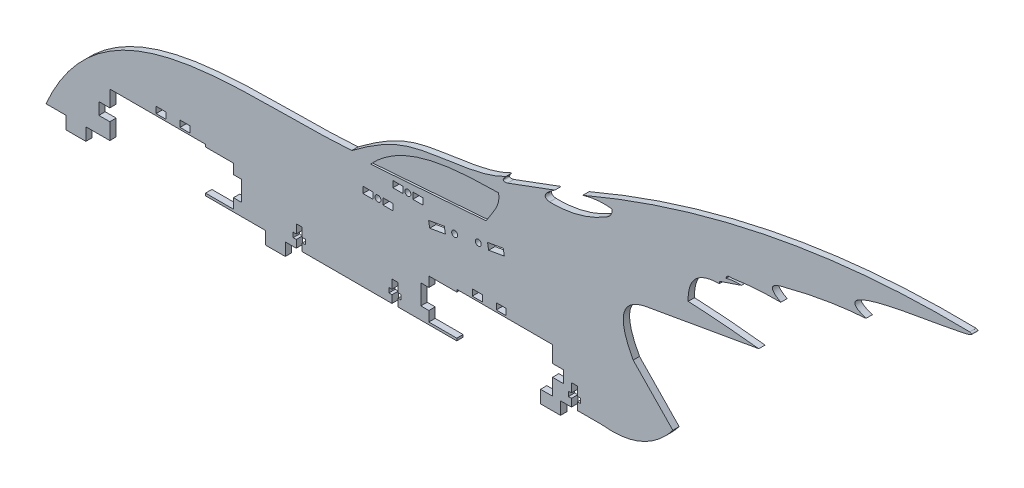
from build123d import *

# Parameters (mm, degrees)
BOSS_EXTRUDE1_DEPTH = 3.175
SKETCH3_W           = 10
SKETCH3_H           = 6.35
BOSS_EXTRUDE2_DEPTH = 3.175
CUT_EXTRUDE1_DEPTH  = 1
CUT_EXTRUDE2_DEPTH  = 309.914260869
SKETCH7_W           = 5
SKETCH7_H           = 3.175
CUT_EXTRUDE3_DEPTH  = 309.914260869
SKETCH8_R           = 1.5
CUT_EXTRUDE4_DEPTH  = 309.914260869
SKETCH9_R           = 1.5
SKETCH9_W           = 5
SKETCH9_H           = 3.175
CUT_EXTRUDE5_DEPTH  = 309.914260869


with BuildPart() as part:
    # Sketch2 → Boss-Extrude1 (new body)
    with BuildSketch(Plane.XY):
        with BuildLine():
            Line((-171.469047232, -34.076589663), (107.072734851, -34.076589663))
            add(Edge.make_bspline(
                [(107.072734851, -34.076589663), (128.968224532, -36.583015685), (142.892082906, -18.715522774)],
                knots=[0, 0, 0, 1, 1, 1], degree=2))
            Line((142.892082906, -18.715522774), (122.99960361, 1.8225486))
            add(Edge.make_bspline(
                [(129.812103759, 28.346921979), (110.367502019, 24.835662341), (122.99960361, 1.8225486)],
                knots=[0, 0, 0, 1, 1, 1], degree=2))
            Line((129.812103759, 28.346921979), (185.982982819, 38.244685161))
            add(Edge.make_bspline(
                [(150.588622768, 41.132714976), (168.332466646, 40.241827569), (185.982982819, 38.244685161)],
                knots=[0, 0, 0, 1, 1, 1], degree=2))
            add(Edge.make_bspline(
                [(166.211544782, 56.600045126), (150.111599454, 56.448151942), (150.588622768, 41.132714976)],
                knots=[0, 0, 0, 1, 1, 1], degree=2))
            Line((166.211544782, 56.600045126), (166.232711914, 57.669663084))
            Line((166.232711914, 57.669663084), (177.243348067, 61.403308501))
            add(Edge.make_bspline(
                [(177.243348067, 61.403308501), (173.339529375, 61.796609349), (169.627135034, 60.610840144)],
                knots=[0, 0, 0, 1, 1, 1], degree=2))
            add(Edge.make_bspline(
                [(169.627135034, 60.610840144), (169.762853876, 62.544945332), (172.402329475, 62.156522878)],
                knots=[0, 0, 0, 1, 1, 1], degree=2))
            add(Edge.make_bspline(
                [(172.402329475, 62.156522878), (184.617311888, 64.041519989), (197.029812567, 63.947302758)],
                knots=[0, 0, 0, 1, 1, 1], degree=2))
            add(Edge.make_bspline(
                [(197.029812567, 63.947302758), (187.73474396, 69.069639789), (198.964387884, 71.402059066)],
                knots=[0, 0, 0, 1, 1, 1], degree=2))
            add(Edge.make_bspline(
                [(198.964387884, 71.402059066), (219.003547299, 76.786528717), (239.76459105, 78.329887141)],
                knots=[0, 0, 0, 1, 1, 1], degree=2))
            add(Edge.make_bspline(
                [(291.780939868, 98.47138823), (303.090852198, 95.717715254), (210.844028254, 88.026417155), (239.76459105, 78.329887141)],
                knots=[0, 0, 0, 0, 1, 1, 1, 1], degree=3))
            add(Edge.make_bspline(
                [(291.780939868, 98.47138823), (190.608851514, 100.539390251), (97.737935683, 60.775941524)],
                knots=[0, 0, 0, 1, 1, 1], degree=2))
            add(Edge.make_bspline(
                [(97.737935683, 60.775941524), (104.92881908, 63.001143493), (112.379572637, 62.156522878)],
                knots=[0, 0, 0, 1, 1, 1], degree=2))
            add(Edge.make_bspline(
                [(112.379572637, 62.156522878), (112.730110756, 59.051830939), (109.55036868, 57.311722682)],
                knots=[0, 0, 0, 1, 1, 1], degree=2))
            add(Edge.make_bspline(
                [(109.55036868, 57.311722682), (96.530025853, 49.246897899), (81.058579137, 49.55282081)],
                knots=[0, 0, 0, 1, 1, 1], degree=2))
            add(Edge.make_bspline(
                [(81.058579137, 49.55282081), (75.642299748, 50.628036984), (83.696612356, 55.998318906)],
                knots=[0, 0, 0, 1, 1, 1], degree=2))
            Line((83.696612356, 55.998318906), (60.023408157, 47.198036308))
            add(Edge.make_bspline(
                [(60.023408157, 47.198036308), (56.150260782, 46.24516321), (59.12376331, 49.613311176)],
                knots=[0, 0, 0, 1, 1, 1], degree=2))
            add(Edge.make_bspline(
                [(59.12376331, 49.613311176), (44.292473838, 41.921501166), (13.209344651, 43.405332099), (-7.707186428, 29.993825045), (-18.106560521, 22.301338951)],
                knots=[0, 0, 0, 0, 0.606338938, 1, 1, 1, 1], degree=3))
            add(Edge.make_bspline(
                [(-18.106560521, 22.301338951), (-73.30010729, 18.178725753), (-142.381543794, 32.928841514), (-171.469047232, -34.076589663)],
                knots=[0, 0, 0, 0, 1, 1, 1, 1], degree=3))
        make_face()
    extrude(amount=BOSS_EXTRUDE1_DEPTH)

    # Sketch3 → Boss-Extrude2 (add)
    with BuildSketch(Plane.XY.offset(3.175)):
        with Locations((-156.469047232, -37.251589663)):
            Rectangle(SKETCH3_W, SKETCH3_H)
        with Locations((-56.469047232, -37.251589663)):
            Rectangle(SKETCH3_W, SKETCH3_H)
        with Locations((81.530952768, -37.251589663)):
            Rectangle(SKETCH3_W, SKETCH3_H)
    extrude(amount=-BOSS_EXTRUDE2_DEPTH)

    # Sketch4 → Cut-Extrude1 (cut)
    with BuildSketch(Plane.XY.offset(3.175)):
        with BuildLine():
            Line((-8.735344321, 21.076667257), (49.27249451, 25.443679203))
            add(Edge.make_bspline(
                [(55.435775055, 40.720887474), (56.710717132, 34.955549426), (51.7521577, 29.95185464), (49.27249451, 25.443679203)],
                knots=[0, 0, 0, 0, 1, 1, 1, 1], degree=3))
            add(Edge.make_bspline(
                [(55.435775055, 40.720887474), (33.054612951, 40.360145045), (7.874054379, 39.272954497), (-8.735344321, 21.076667257)],
                knots=[0, 0, 0, 0, 1, 1, 1, 1], degree=3))
        make_face()
    extrude(amount=-CUT_EXTRUDE1_DEPTH, mode=Mode.SUBTRACT)

    # Sketch5 → Cut-Extrude2 (cut, through all)
    with BuildSketch(Plane.XY.offset(3.175)):
        Polygon((-45.969047232, -34.076589663), (-42.969047232, -34.076589663), (-42.969047232, -30.276589663), (-41.419047232, -30.276589663), (-41.419047232, -27.876589663), (-42.969047232, -27.876589663), (-42.969047232, -23.426589663), (-45.969047232, -23.426589663), (-45.969047232, -27.876589663), (-47.519047232, -27.876589663), (-47.519047232, -30.276589663), (-45.969047232, -30.276589663), align=None)
        Polygon((2.030952768, -30.276589663), (2.030952768, -34.076589663), (5.030952768, -34.076589663), (5.030952768, -30.276589663), (6.580952768, -30.276589663), (6.580952768, -27.876589663), (5.030952768, -27.876589663), (5.030952768, -23.426589663), (2.030952768, -23.426589663), (2.030952768, -27.876589663), (0.480952768, -27.876589663), (0.480952768, -30.276589663), align=None)
        Polygon((92.030952768, -30.276589663), (92.030952768, -34.076589663), (95.030952768, -34.076589663), (95.030952768, -30.276589663), (96.580952768, -30.276589663), (96.580952768, -27.876589663), (95.030952768, -27.876589663), (95.030952768, -23.426589663), (92.030952768, -23.426589663), (92.030952768, -27.876589663), (90.480952768, -27.876589663), (90.480952768, -30.276589663), align=None)
    extrude(amount=-CUT_EXTRUDE2_DEPTH, mode=Mode.SUBTRACT)

    # Sketch7 → Cut-Extrude3 (cut, through all)
    with BuildSketch(Plane.XY.offset(3.175)):
        Polygon((-91.469047232, -32.876589663), (-77.469047232, -32.876589663), (-77.469047232, -27.876589663), (-73.469047232, -27.876589663), (-73.469047232, -17.876589663), (-77.469047232, -17.876589663), (-77.469047232, -12.876589663), (-91.469047232, -12.876589663), (-91.469047232, -11.676589663), (-139.469047232, -11.676589663), (-139.469047232, -19.876589663), (-144.969047232, -19.876589663), (-144.969047232, -25.876589663), (-139.469047232, -25.876589663), (-139.469047232, -34.076589663), (-91.469047232, -34.076589663), align=None)
        Polygon((20.530952768, -27.876589663), (20.530952768, -32.876589663), (34.530952768, -32.876589663), (34.530952768, -34.076589663), (82.530952768, -34.076589663), (82.530952768, -25.876589663), (88.030952768, -25.876589663), (88.030952768, -19.876589663), (82.530952768, -19.876589663), (82.530952768, -11.676589663), (34.530952768, -11.676589663), (34.530952768, -12.876589663), (20.530952768, -12.876589663), (20.530952768, -17.876589663), (16.530952768, -17.876589663), (16.530952768, -27.876589663), align=None)
        with Locations((-113.769047232, -9.149089663)):
            Rectangle(SKETCH7_W, SKETCH7_H)
        with Locations((-101.769047232, -9.149089663)):
            Rectangle(SKETCH7_W, SKETCH7_H)
        with Locations((44.830952768, -9.149089663)):
            Rectangle(SKETCH7_W, SKETCH7_H)
        with Locations((56.830952768, -9.149089663)):
            Rectangle(SKETCH7_W, SKETCH7_H)
    extrude(amount=-CUT_EXTRUDE3_DEPTH, mode=Mode.SUBTRACT)

    # Sketch8 → Cut-Extrude4 (cut, through all)
    with BuildSketch(Plane.XY.offset(3.175)):
        with Locations((33.483463602, 11.904038041)):
            Circle(SKETCH8_R)
        with Locations(Location((45.301156639, 13.987816173, 0), (0, 0, 180))):
            Circle(SKETCH8_R)
        Polygon((20.956629295, 8.083229423), (28.835091319, 9.472414844), (28.283758355, 12.59917946), (20.405296331, 11.209994039), align=None)
        Polygon((57.827990946, 17.80862479), (49.949528922, 16.419439369), (50.500861886, 13.292674753), (58.37932391, 14.681860174), align=None)
    extrude(amount=-CUT_EXTRUDE4_DEPTH, mode=Mode.SUBTRACT)

    # Sketch9 → Cut-Extrude5 (cut, through all)
    with BuildSketch(Plane.XY.offset(3.175)):
        with Locations((10, 18)):
            Circle(SKETCH9_R)
        with Locations((-5, 8)):
            Circle(SKETCH9_R)
        with Locations((15, 18)):
            Rectangle(SKETCH9_W, SKETCH9_H)
        with Locations((5, 18)):
            Rectangle(SKETCH9_W, SKETCH9_H)
        with Locations((-10, 8)):
            Rectangle(SKETCH9_W, SKETCH9_H)
        with Locations((0, 8)):
            Rectangle(SKETCH9_W, SKETCH9_H)
    extrude(amount=-CUT_EXTRUDE5_DEPTH, mode=Mode.SUBTRACT)


solid = part.part
